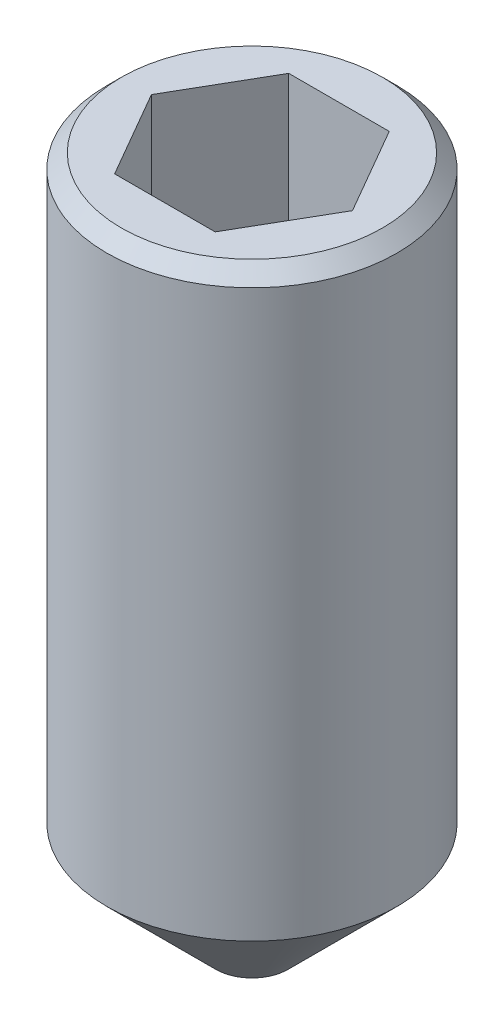
from build123d import *

# Parameters (mm, degrees)
CUT_EXTRUDE_1_DEPTH = 1.5
CHAMFER_1_SIZE      = 0.1


with BuildPart() as part:
    # 草图1 → 旋转1 (revolve)
    with BuildSketch(Plane.XY, mode=Mode.PRIVATE) as revolve_1_sk:
        Polygon((0, 0), (1, 0), (1, -4), (0.25, -4.75), (0, -4.75), align=None)
    revolve(revolve_1_sk.sketch.rotate(Axis((0, 8.713500289, 0), (0, -1, 0)), 90), axis=Axis((0, 8.713500289, 0), (0, -1, 0)))

    # 草图2 → 切除-拉伸1 (cut)
    with BuildSketch(Plane(origin=(0, 0, 0), x_dir=(1, 0, 0), z_dir=(0, 1, 0))):
        Polygon((-0.346410162, -0.6), (0.346410162, -0.6), (0.692820323, 0), (0.346410162, 0.6), (-0.346410162, 0.6), (-0.692820323, 0), align=None)
    extrude(amount=-CUT_EXTRUDE_1_DEPTH, mode=Mode.SUBTRACT)

    # 倒角1
    chamfer_1_edges = [part.edges().sort_by_distance(p)[0] for p in [
        (0, 0, -1),
    ]]
    chamfer(chamfer_1_edges, length=CHAMFER_1_SIZE)


solid = part.part
